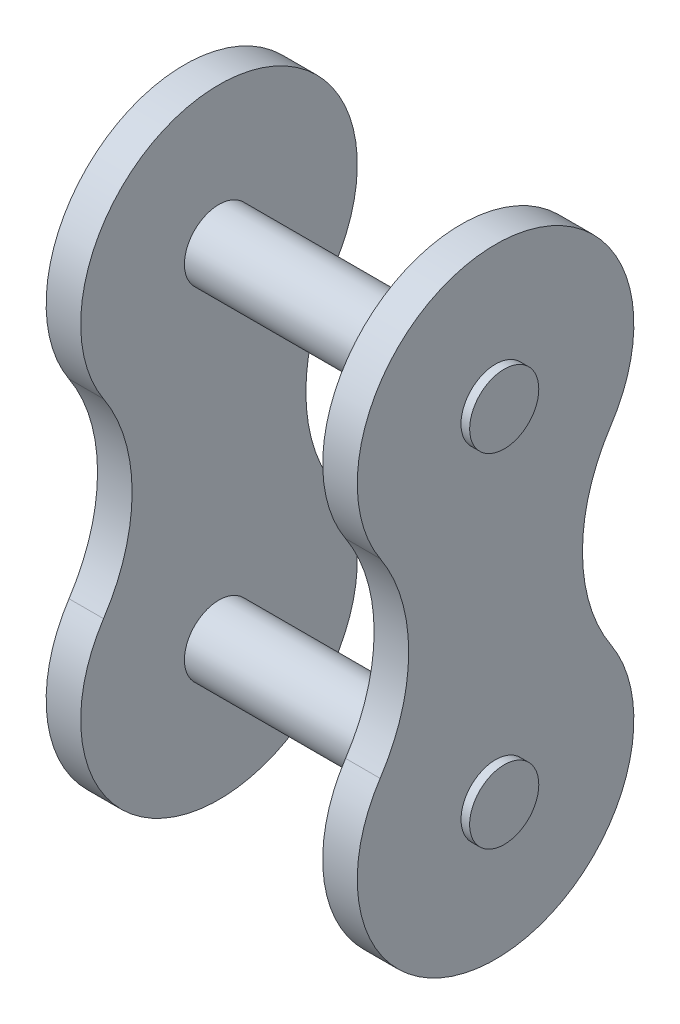
from build123d import *

# Parameters (mm, degrees)
BOSS_EXTRUDE1_START = 3.5
SKETCH1_R           = 1
BOSS_EXTRUDE1_DEPTH = 1
SKETCH2_R           = 1
BOSS_EXTRUDE2_DEPTH = 4.75


with BuildPart() as part:
    # Sketch1 → Boss-Extrude1 (new body)
    with BuildSketch(Plane.YZ.offset(BOSS_EXTRUDE1_START)):
        with BuildLine():
            ThreePointArc((-2.752777778, 3.339194107), (-8.955, 0), (-2.752777778, -3.339194107))
            ThreePointArc((-2.752777778, -3.339194107), (0, -2.513186741), (2.752777778, -3.339194107))
            ThreePointArc((2.752777778, -3.339194107), (8.955, 0), (2.752777778, 3.339194107))
            ThreePointArc((2.752777778, 3.339194107), (0, 2.513186741), (-2.752777778, 3.339194107))
        make_face()
        with Locations(Location((-4.955, 0, 0), (0, 0, 270))):
            Circle(SKETCH1_R, mode=Mode.SUBTRACT)
        with Locations(Location((4.955, 0, 0), (0, 0, 90))):
            Circle(SKETCH1_R, mode=Mode.SUBTRACT)
    extrude(amount=BOSS_EXTRUDE1_DEPTH)


with BuildPart() as body_2:
    # Mirror2: mirrored copy
    add(part.part.mirror(Plane(origin=(0, 0, 0), x_dir=(0, 0, 1), z_dir=(1, 0, 0))))


with BuildPart() as part_1:
    add(part.part)

    add(body_2.part)  # Boss-Extrude2 merges body 2
    # Sketch2 → Boss-Extrude2 (add, symmetric)
    with BuildSketch(Plane.YZ):
        with Locations(Location((-4.955, 0, 0), (0, 0, 90))):
            Circle(SKETCH2_R)
        with Locations(Location((4.955, 0, 0), (0, 0, 90))):
            Circle(SKETCH2_R)
    extrude(amount=BOSS_EXTRUDE2_DEPTH, both=True)


solid = part_1.part
